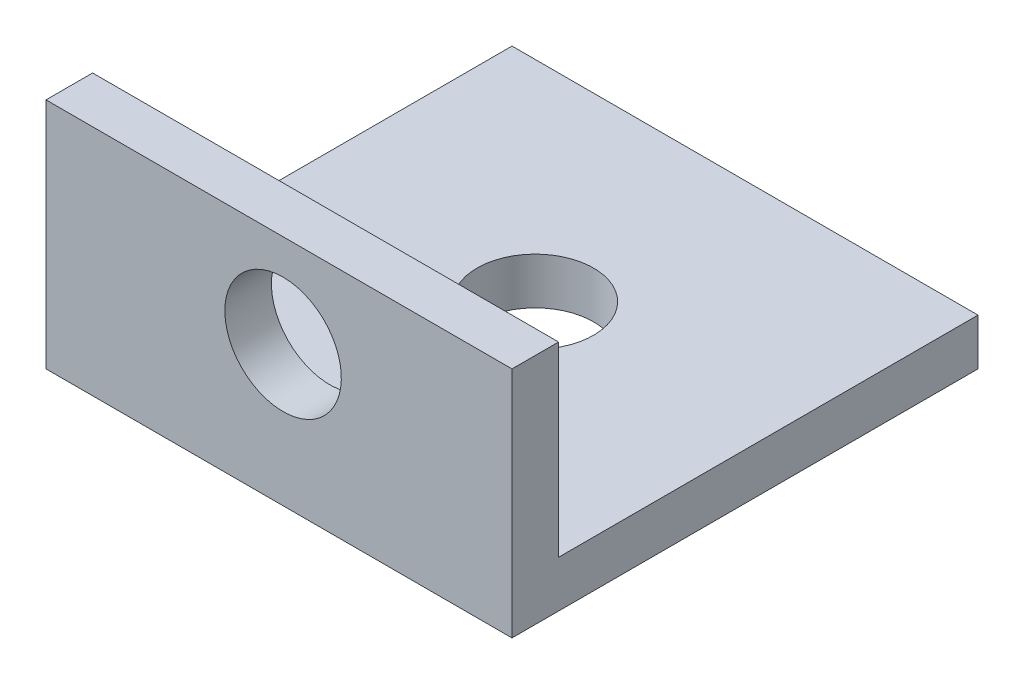
from build123d import *

# Parameters (mm, degrees)
BOSS_EXTRUDE1_DEPTH = 20
SKETCH2_R           = 2.5
CUT_EXTRUDE1_DEPTH  = 2
SKETCH3_R           = 2.5
CUT_EXTRUDE2_DEPTH  = 2


with BuildPart() as part:
    # Sketch1 → Boss-Extrude1 (new body)
    with BuildSketch(Plane(origin=(0, 0, 0), x_dir=(0, 0, -1), z_dir=(1, 0, 0))):
        Polygon((0, 10), (0, 0), (20, 0), (20, 2), (2, 2), (2, 10), align=None)
    extrude(amount=BOSS_EXTRUDE1_DEPTH)

    # Sketch2 → Cut-Extrude1 (cut)
    with BuildSketch(Plane(origin=(0, 0, -2), x_dir=(-1, 0, 0), z_dir=(0, 0, -1))):
        with Locations(Location((-10.174868447, 6, 0), (0, 0, 90))):
            Circle(SKETCH2_R)
    extrude(amount=-CUT_EXTRUDE1_DEPTH, mode=Mode.SUBTRACT)

    # Sketch3 → Cut-Extrude2 (cut)
    with BuildSketch(Plane(origin=(0, 2, 0), x_dir=(1, 0, 0), z_dir=(0, 1, 0))):
        with Locations(Location((10, 11, 0), (0, 0, 270))):
            Circle(SKETCH3_R)
    extrude(amount=-CUT_EXTRUDE2_DEPTH, mode=Mode.SUBTRACT)


solid = part.part
